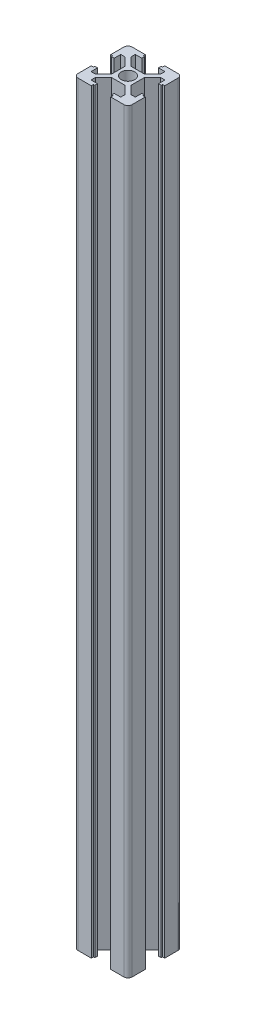
from build123d import *

# Parameters (mm, degrees)
SKETCH_1_R      = 2.5
EXTRUDE_1_DEPTH = 140


with BuildPart() as part:
    # 草图1 → 凸台-拉伸1 (new, symmetric)
    with BuildSketch(Plane(origin=(0, 0, 0), x_dir=(1, 0, 0), z_dir=(0, 1, 0))):
        with BuildLine():
            Line((15.752176799, 53.551974455), (15.752176799, 48.473294799))
            Line((15.752176799, 48.473294799), (12.791516627, 45.512634627))
            Line((12.791516627, 45.512634627), (11.152176799, 45.512634627))
            Line((11.152176799, 45.512634627), (11.152176799, 47.912634627))
            Line((11.152176799, 47.912634627), (10.152176799, 47.912634627))
            Line((10.152176799, 47.912634627), (10.152176799, 47.412634627))
            Line((10.152176799, 47.412634627), (9.352176799, 47.412634627))
            Line((9.352176799, 47.412634627), (9.352176799, 42.512634627))
            ThreePointArc((9.352176799, 42.512634627), (9.791516627, 41.451974455), (10.852176799, 41.012634627))
            Line((10.852176799, 41.012634627), (15.752176799, 41.012634627))
            Line((15.752176799, 41.012634627), (15.752176799, 41.812634627))
            Line((15.752176799, 41.812634627), (16.252176799, 41.812634627))
            Line((16.252176799, 41.812634627), (16.252176799, 42.812634627))
            Line((16.252176799, 42.812634627), (13.852176799, 42.812634627))
            Line((13.852176799, 42.812634627), (13.852176799, 44.451974455))
            Line((13.852176799, 44.451974455), (16.812836971, 47.412634627))
            Line((16.812836971, 47.412634627), (21.891516627, 47.412634627))
            Line((21.891516627, 47.412634627), (24.852176799, 44.451974455))
            Line((24.852176799, 44.451974455), (24.852176799, 42.812634627))
            Line((24.852176799, 42.812634627), (22.452176799, 42.812634627))
            Line((22.452176799, 42.812634627), (22.452176799, 41.812634627))
            Line((22.452176799, 41.812634627), (22.952176799, 41.812634627))
            Line((22.952176799, 41.812634627), (22.952176799, 41.012634627))
            Line((22.952176799, 41.012634627), (27.852176799, 41.012634627))
            ThreePointArc((27.852176799, 41.012634627), (28.912836971, 41.451974455), (29.352176799, 42.512634627))
            Line((29.352176799, 42.512634627), (29.352176799, 47.412634627))
            Line((29.352176799, 47.412634627), (28.552176799, 47.412634627))
            Line((28.552176799, 47.412634627), (28.552176799, 47.912634627))
            Line((28.552176799, 47.912634627), (27.552176799, 47.912634627))
            Line((27.552176799, 47.912634627), (27.552176799, 45.512634627))
            Line((27.552176799, 45.512634627), (25.912836971, 45.512634627))
            Line((25.912836971, 45.512634627), (22.952176799, 48.473294799))
            Line((22.952176799, 48.473294799), (22.952176799, 53.551974455))
            Line((22.952176799, 53.551974455), (25.912836971, 56.512634627))
            Line((25.912836971, 56.512634627), (27.552176799, 56.512634627))
            Line((27.552176799, 56.512634627), (27.552176799, 54.112634627))
            Line((27.552176799, 54.112634627), (28.552176799, 54.112634627))
            Line((28.552176799, 54.112634627), (28.552176799, 54.612634627))
            Line((28.552176799, 54.612634627), (29.352176799, 54.612634627))
            Line((29.352176799, 54.612634627), (29.352176799, 59.512634627))
            ThreePointArc((29.352176799, 59.512634627), (28.912836971, 60.573294799), (27.852176799, 61.012634627))
            Line((27.852176799, 61.012634627), (22.952176799, 61.012634627))
            Line((22.952176799, 61.012634627), (22.952176799, 60.212634627))
            Line((22.952176799, 60.212634627), (22.452176799, 60.212634627))
            Line((22.452176799, 60.212634627), (22.452176799, 59.212634627))
            Line((22.452176799, 59.212634627), (24.852176799, 59.212634627))
            Line((24.852176799, 59.212634627), (24.852176799, 57.573294799))
            Line((24.852176799, 57.573294799), (21.891516627, 54.612634627))
            Line((21.891516627, 54.612634627), (16.812836971, 54.612634627))
            Line((16.812836971, 54.612634627), (13.852176799, 57.573294799))
            Line((13.852176799, 57.573294799), (13.852176799, 59.212634627))
            Line((13.852176799, 59.212634627), (16.252176799, 59.212634627))
            Line((16.252176799, 59.212634627), (16.252176799, 60.212634627))
            Line((16.252176799, 60.212634627), (15.752176799, 60.212634627))
            Line((15.752176799, 60.212634627), (15.752176799, 61.012634627))
            Line((15.752176799, 61.012634627), (10.852176799, 61.012634627))
            ThreePointArc((10.852176799, 61.012634627), (9.791516627, 60.573294799), (9.352176799, 59.512634627))
            Line((9.352176799, 59.512634627), (9.352176799, 54.612634627))
            Line((9.352176799, 54.612634627), (10.152176799, 54.612634627))
            Line((10.152176799, 54.612634627), (10.152176799, 54.112634627))
            Line((10.152176799, 54.112634627), (11.152176799, 54.112634627))
            Line((11.152176799, 54.112634627), (11.152176799, 56.512634627))
            Line((11.152176799, 56.512634627), (12.791516627, 56.512634627))
            Line((12.791516627, 56.512634627), (15.752176799, 53.551974455))
        make_face()
        with Locations(Location((19.352176799, 51.012634627, 0), (0, 0, 270))):
            Circle(SKETCH_1_R, mode=Mode.SUBTRACT)
    extrude(amount=EXTRUDE_1_DEPTH, both=True)


solid = part.part
